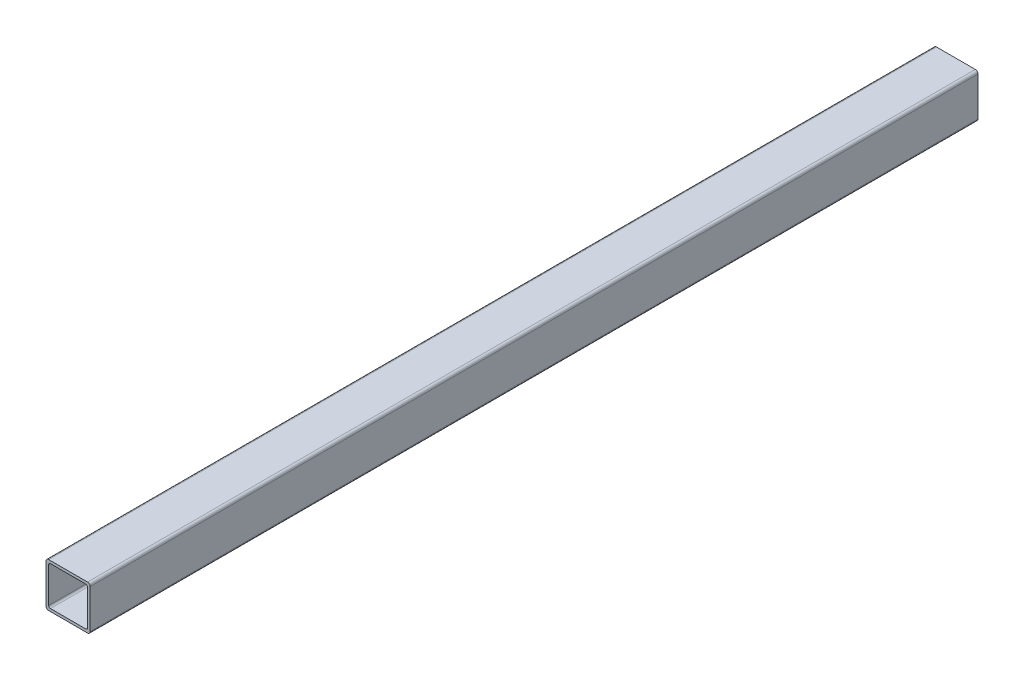
from build123d import *

# Parameters (mm, degrees)
EXTRUDE_1_DEPTH = 1005


with BuildPart() as part:
    # Эскиз1 → Бобышка-Вытянуть1 (new body)
    with BuildSketch(Plane.XY):
        with BuildLine():
            Line((-47, 0), (-3, 0))
            ThreePointArc((-3, 0), (-0.878679656, -0.878679656), (0, -3))
            Line((0, -3), (0, -47))
            ThreePointArc((0, -47), (-0.878679656, -49.121320344), (-3, -50))
            Line((-3, -50), (-47, -50))
            ThreePointArc((-47, -50), (-49.121320344, -49.121320344), (-50, -47))
            Line((-50, -47), (-50, -3))
            ThreePointArc((-50, -3), (-49.121320344, -0.878679656), (-47, 0))
        make_face()
        with BuildLine():
            Line((-45, -3), (-5, -3))
            ThreePointArc((-5, -3), (-3.585786438, -3.585786438), (-3, -5))
            Line((-3, -5), (-3, -45))
            ThreePointArc((-3, -45), (-3.585786438, -46.414213562), (-5, -47))
            Line((-5, -47), (-45, -47))
            ThreePointArc((-45, -47), (-46.414213562, -46.414213562), (-47, -45))
            Line((-47, -45), (-47, -5))
            ThreePointArc((-47, -5), (-46.414213562, -3.585786438), (-45, -3))
        make_face(mode=Mode.SUBTRACT)
    extrude(amount=-EXTRUDE_1_DEPTH)


solid = part.part
